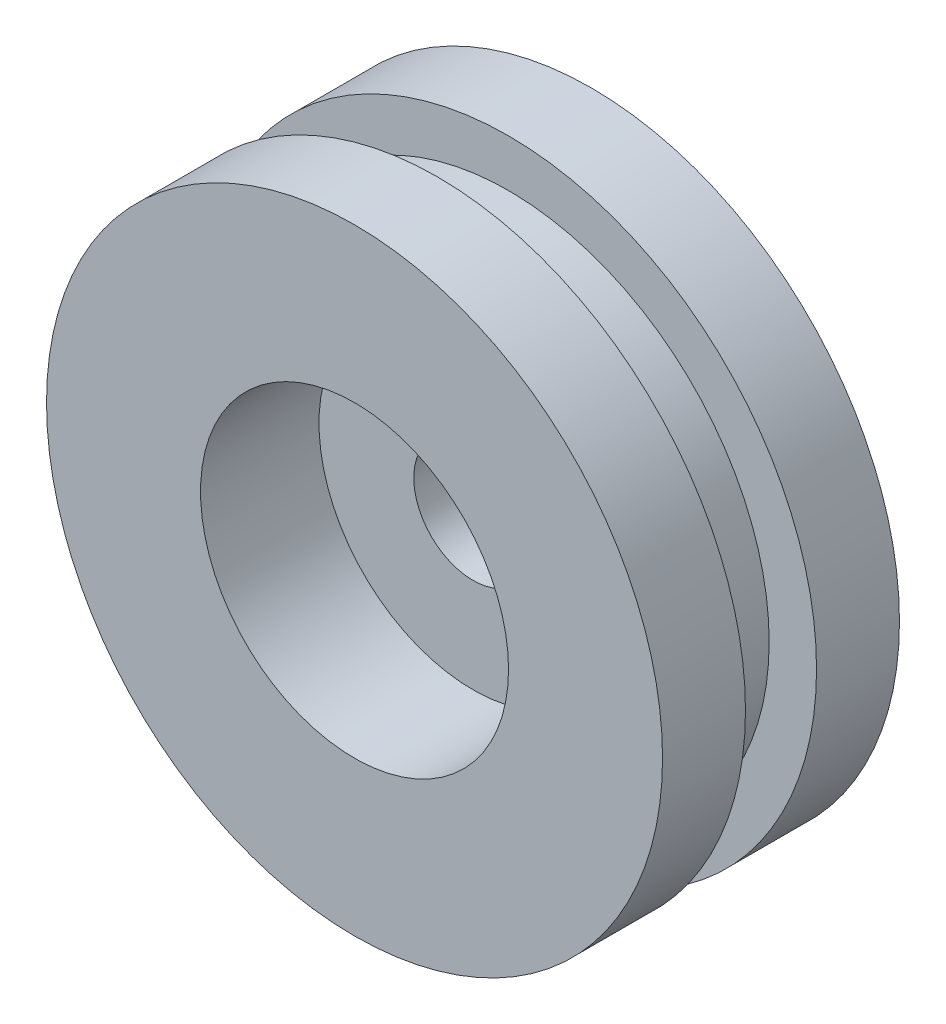
from build123d import *

# Parameters (mm, degrees)
SKETCH1_R           = 11
SKETCH1_R_2         = 6.5
BOSS_EXTRUDE1_DEPTH = 5
BOSS_EXTRUDE2_START = 5
SKETCH1_3_R         = 13
SKETCH1_3_R_2       = 11
BOSS_EXTRUDE2_DEPTH = 3.5
BOSS_EXTRUDE3_START = -5
SKETCH1_5_R         = 6.5
SKETCH1_5_R_2       = 2.5
BOSS_EXTRUDE3_DEPTH = 5
BOSS_EXTRUDE4_START = -1.5
SKETCH1_6_R         = 13
SKETCH1_6_R_2       = 11
BOSS_EXTRUDE4_DEPTH = 3.5


with BuildPart() as part:
    # Sketch1 → Boss-Extrude1 (new, symmetric)
    with BuildSketch(Plane.XY):
        Circle(SKETCH1_R)
        Circle(SKETCH1_R_2, mode=Mode.SUBTRACT)
    extrude(amount=BOSS_EXTRUDE1_DEPTH, both=True)

    # Sketch1<3> → Boss-Extrude2 (add)
    with BuildSketch(Plane.XY.offset(BOSS_EXTRUDE2_START)):
        Circle(SKETCH1_3_R)
        Circle(SKETCH1_3_R_2, mode=Mode.SUBTRACT)
    extrude(amount=-BOSS_EXTRUDE2_DEPTH)

    # Sketch1<5> → Boss-Extrude3 (add)
    with BuildSketch(Plane.XY.offset(BOSS_EXTRUDE3_START)):
        Circle(SKETCH1_5_R)
        Circle(SKETCH1_5_R_2, mode=Mode.SUBTRACT)
    extrude(amount=BOSS_EXTRUDE3_DEPTH)

    # Sketch1<6> → Boss-Extrude4 (add)
    with BuildSketch(Plane.XY.offset(BOSS_EXTRUDE4_START)):
        Circle(SKETCH1_6_R)
        Circle(SKETCH1_6_R_2, mode=Mode.SUBTRACT)
    extrude(amount=-BOSS_EXTRUDE4_DEPTH)


solid = part.part
